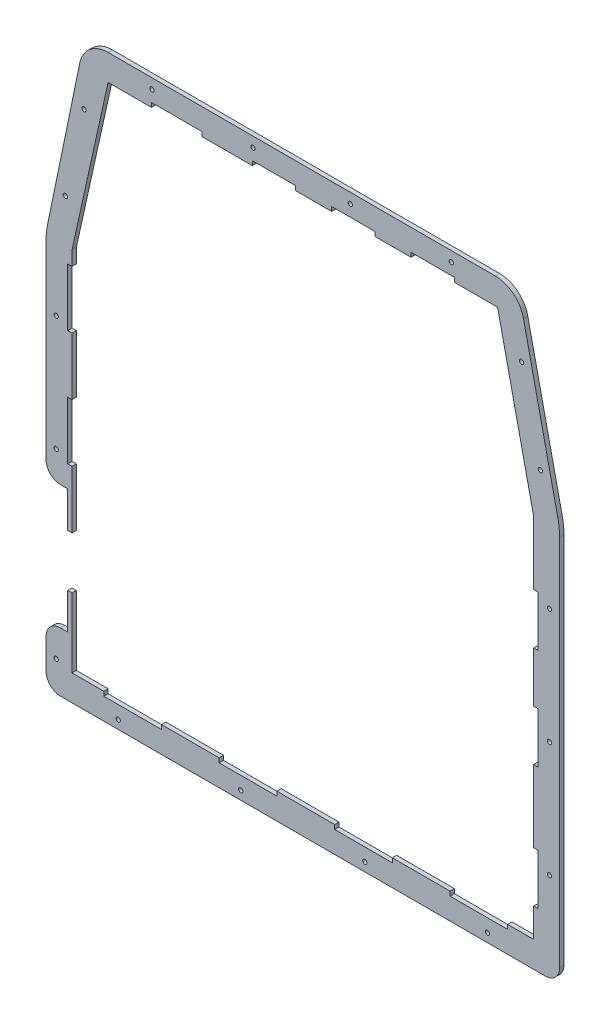
from build123d import *

# Parameters (mm, degrees)
SKETCH1_R           = 1.5
BOSS_EXTRUDE1_DEPTH = 3
SKETCH2_W           = 40
SKETCH2_H           = 3
SKETCH2_W_2         = 3
SKETCH2_H_2         = 36
SKETCH2_H_3         = 40
SKETCH2_W_3         = 35
SKETCH2_W_4         = 30
SKETCH2_H_4         = 35
CUT_EXTRUDE1_DEPTH  = 3


with BuildPart() as part:
    # Sketch1 → Boss-Extrude1 (new body)
    with BuildSketch(Plane.XY.offset(-1194.952985965)):
        with BuildLine():
            ThreePointArc((-135, 1558.280393103), (-147.632217989, 1553.786103944), (-154.587151942, 1542.323099971))
            Line((-154.587151942, 1542.323099971), (-176.967879854, 1433.887160273))
            ThreePointArc((-176.967879854, 1433.887160273), (-177.74130071, 1428.860058806), (-178, 1423.780393103))
            Line((-178, 1423.780393103), (-178, 1292.280393103))
            ThreePointArc((-178, 1292.280393103), (-175.071067812, 1285.209325291), (-168, 1282.280393103))
            Line((-168, 1282.280393103), (-163, 1282.280393103))
            Line((-163, 1282.280393103), (-163, 1196.280393103))
            Line((-163, 1196.280393103), (-168, 1196.280393103))
            ThreePointArc((-168, 1196.280393103), (-175.071067812, 1193.351460915), (-178, 1186.280393103))
            Line((-178, 1186.280393103), (-178, 1165.280393103))
            ThreePointArc((-178, 1165.280393103), (-175.071067812, 1158.209325291), (-168, 1155.280393103))
            Line((-168, 1155.280393103), (168, 1155.280393103))
            ThreePointArc((168, 1155.280393103), (175.071067812, 1158.209325291), (178, 1165.280393103))
            Line((178, 1165.280393103), (178, 1423.782857009))
            ThreePointArc((178, 1423.782857009), (177.70399808, 1429.215404737), (176.819497007, 1434.583630683))
            Line((176.819497007, 1434.583630683), (152.921914731, 1542.600702573))
            ThreePointArc((152.921914731, 1542.600702573), (145.915973031, 1553.875363276), (133.394115928, 1558.280393103))
            Line((133.394115928, 1558.280393103), (-135, 1558.280393103))
        make_face()
        with Locations((-171, 1176.280393103)):
            Circle(SKETCH1_R, mode=Mode.SUBTRACT)
        with Locations((-128, 1161.280393103)):
            Circle(SKETCH1_R, mode=Mode.SUBTRACT)
        with Locations((-43, 1161.280393103)):
            Circle(SKETCH1_R, mode=Mode.SUBTRACT)
        with Locations((-171, 1302.280393103)):
            Circle(SKETCH1_R, mode=Mode.SUBTRACT)
        with Locations((43, 1161.280393103)):
            Circle(SKETCH1_R, mode=Mode.SUBTRACT)
        with Locations((128, 1161.280393103)):
            Circle(SKETCH1_R, mode=Mode.SUBTRACT)
        with Locations((171, 1217.280393103)):
            Circle(SKETCH1_R, mode=Mode.SUBTRACT)
        with Locations((171, 1297.280393103)):
            Circle(SKETCH1_R, mode=Mode.SUBTRACT)
        with Locations((-171, 1382.280393103)):
            Circle(SKETCH1_R, mode=Mode.SUBTRACT)
        with Locations((-164.628822574, 1457.280393103)):
            Circle(SKETCH1_R, mode=Mode.SUBTRACT)
        with Locations((-151.667894165, 1515.863789512)):
            Circle(SKETCH1_R, mode=Mode.SUBTRACT)
        with Locations((-104.587151942, 1551.280393103)):
            Circle(SKETCH1_R, mode=Mode.SUBTRACT)
        with Locations((-34.587151942, 1551.280393103)):
            Circle(SKETCH1_R, mode=Mode.SUBTRACT)
        Polygon((160, 1173.280393103), (-160, 1173.280393103), (-160, 1282.280393103), (-160, 1427.280393103), (-135, 1540.280393103), (135, 1540.280393103), (160, 1427.280393103), align=None, mode=Mode.SUBTRACT)
        with Locations((171, 1377.280393103)):
            Circle(SKETCH1_R, mode=Mode.SUBTRACT)
        with Locations((164.628822573, 1457.280393103)):
            Circle(SKETCH1_R, mode=Mode.SUBTRACT)
        with Locations((32.921914731, 1551.280393103)):
            Circle(SKETCH1_R, mode=Mode.SUBTRACT)
        with Locations((102.921914731, 1551.280393103)):
            Circle(SKETCH1_R, mode=Mode.SUBTRACT)
        with Locations((151.667894164, 1515.863789512)):
            Circle(SKETCH1_R, mode=Mode.SUBTRACT)
    extrude(amount=BOSS_EXTRUDE1_DEPTH)

    # Sketch2 → Cut-Extrude1 (cut)
    with BuildSketch(Plane.XY.offset(-1191.952985965)):
        with Locations((-118, 1171.780393103)):
            Rectangle(SKETCH2_W, SKETCH2_H)
        with Locations((-38, 1171.780393103)):
            Rectangle(SKETCH2_W, SKETCH2_H)
        with Locations((42, 1171.780393103)):
            Rectangle(SKETCH2_W, SKETCH2_H)
        with Locations((122, 1171.780393103)):
            Rectangle(SKETCH2_W, SKETCH2_H)
        with Locations((-161.5, 1239.280393103)):
            Rectangle(SKETCH2_W_2, SKETCH2_H_2)
        with Locations((-161.5, 1317.280393103)):
            Rectangle(SKETCH2_W_2, SKETCH2_H_3)
        with Locations((-161.5, 1397.280393103)):
            Rectangle(SKETCH2_W_2, SKETCH2_H_3)
        with Locations((-87.5, 1541.780393103)):
            Rectangle(SKETCH2_W_3, SKETCH2_H)
        with Locations((-20, 1541.780393103)):
            Rectangle(SKETCH2_W_4, SKETCH2_H)
        with Locations((35, 1541.780393103)):
            Rectangle(SKETCH2_W_4, SKETCH2_H)
        with Locations((90, 1541.780393103)):
            Rectangle(SKETCH2_W_4, SKETCH2_H)
        with Locations((161.5, 1295.780393103)):
            Rectangle(SKETCH2_W_2, SKETCH2_H_4)
        with Locations((161.5, 1210.780393103)):
            Rectangle(SKETCH2_W_2, SKETCH2_H_4)
        with Locations((161.5, 1365.780393103)):
            Rectangle(SKETCH2_W_2, SKETCH2_H_4)
    extrude(amount=-CUT_EXTRUDE1_DEPTH, mode=Mode.SUBTRACT)


solid = part.part
